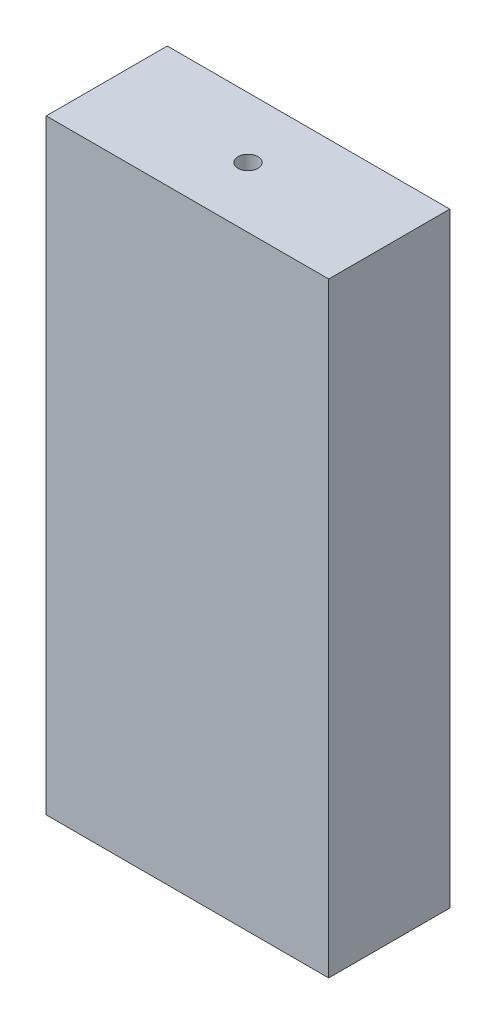
from build123d import *

# Parameters (mm, degrees)
SKETCH1_W           = 88.9
SKETCH1_H           = 38.1
SKETCH1_R           = 3.175
BOSS_EXTRUDE1_DEPTH = 190.5


with BuildPart() as part:
    # Sketch1 → Boss-Extrude1 (new body)
    with BuildSketch(Plane(origin=(0, 0, 0), x_dir=(1, 0, 0), z_dir=(0, 1, 0))):
        with Locations((44.45, 19.05)):
            Rectangle(SKETCH1_W, SKETCH1_H)
        with Locations(Location((44.45, 19.05, 0), (0, 0, 270))):
            Circle(SKETCH1_R, mode=Mode.SUBTRACT)
    extrude(amount=BOSS_EXTRUDE1_DEPTH)


solid = part.part
